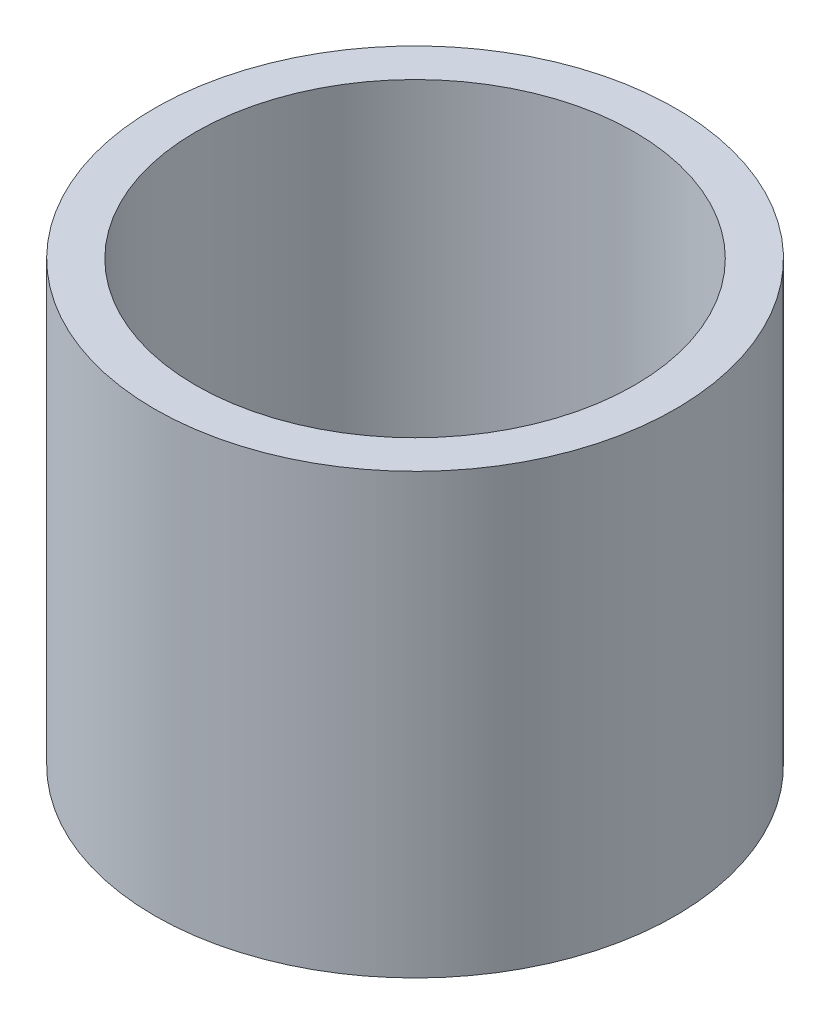
from build123d import *

# Parameters (mm, degrees)
SKETCH1_R           = 7.540625
SKETCH1_R_2         = 6.35
BOSS_EXTRUDE1_DEPTH = 12.7


with BuildPart() as part:
    # Sketch1 → Boss-Extrude1 (new body)
    with BuildSketch(Plane(origin=(0, 0, 0), x_dir=(1, 0, 0), z_dir=(0, 1, 0))):
        with Locations(Location((0, 0, 0), (0, 0, 270))):
            Circle(SKETCH1_R)
        with Locations(Location((0, 0, 0), (0, 0, 270))):
            Circle(SKETCH1_R_2, mode=Mode.SUBTRACT)
    extrude(amount=BOSS_EXTRUDE1_DEPTH)


solid = part.part
